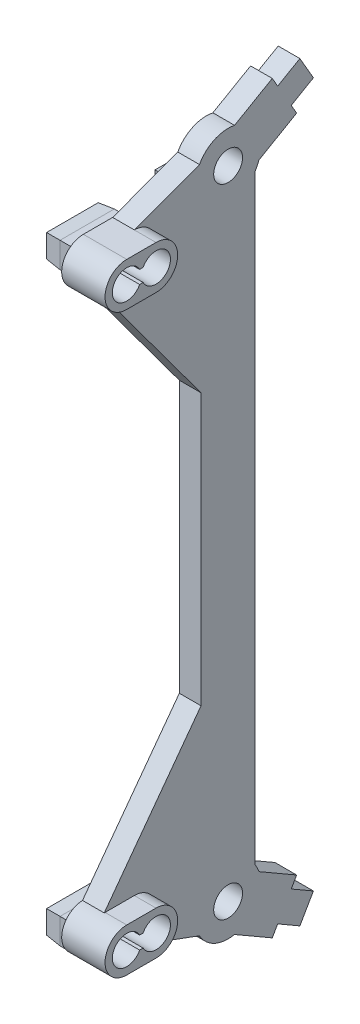
from build123d import *

# Parameters (mm, degrees)
SKETCH3_R                   = 3.81
DOWELSUPPORT_DEPTH          = 1.27
SKETCH5_W                   = 6.35
SKETCH5_H                   = 44.45
SLIDERDOWELSUPPORT_DEPTH    = 1.27
LATERALSUPPORT_DEPTH        = 1.27
SKETCH8_W                   = 6.35
SKETCH8_H                   = 3
TABSUPPORT_DEPTH            = 1.27
STRINGDOWELSUPPORT_START    = -1.27
STRINGDOWELSUPPORT_DEPTH    = 5.08
INTERSUPPORT_DEPTH          = 1.27
SKETCH10_W                  = 6.35
SKETCH10_H                  = 3
TABBASE_DEPTH               = 1.27
SKETCH12_W                  = 6.35
SKETCH12_H                  = 3
TABDRAFT_DEPTH              = 1.73
TABDRAFT_DRAFT              = 5
TABDRAFT_PROFILE_2_DEPTH    = 1.73
TABDRAFT_PROFILE_2_DRAFT    = 5
STRINGDOWELHOLES_DEPTH      = 48.469574456
STRINGDOWELHOLES_DEPTH_BACK = 1.524
SKETCH14_R                  = 1.690500048
PULLEYDOWELHOLE_DEPTH       = 2.54


with BuildPart() as part:
    # Sketch3 → DowelSupport (new, symmetric)
    with BuildSketch(Plane(origin=(0, 0, 0), x_dir=(0, 0, -1), z_dir=(1, 0, 0))):
        with Locations((0, 37.30625)):
            Circle(SKETCH3_R)
    extrude(amount=DOWELSUPPORT_DEPTH, both=True)

    # Sketch8 → TabSupport (add, symmetric)
    with BuildSketch(Plane(origin=(0, 0, 0), x_dir=(0, 0, -1), z_dir=(1, 0, 0))):
        with Locations((0, 34.29)):
            Rectangle(SKETCH8_W, SKETCH8_H)
        with Locations((-12.7, 34.29)):
            Rectangle(SKETCH8_W, SKETCH8_H)
    extrude(amount=TABSUPPORT_DEPTH, both=True)


with BuildPart() as body_2:
    # Sketch5 → SliderDowelSupport (new, symmetric)
    with BuildSketch(Plane(origin=(0, 0, 0), x_dir=(0, 0, -1), z_dir=(1, 0, 0))):
        Rectangle(SKETCH5_W, SKETCH5_H)
    extrude(amount=SLIDERDOWELSUPPORT_DEPTH, both=True)



with BuildPart() as body_3:
    # Sketch6 → LateralSupport (new, symmetric)
    with BuildSketch(Plane(origin=(0, 0, 0), x_dir=(0, 0, -1), z_dir=(1, 0, 0))):
        Polygon((7.392863577, 39.741434671), (5.805363577, 42.491065329), (8.403439788, 43.991065329), (9.990939788, 41.241434671), align=None)
    extrude(amount=LATERALSUPPORT_DEPTH, both=True)


with BuildPart() as tabsupport_piece_1:
    # of the separate pieces the step leaves, piece 1, a body of its own (tabsupport_pieces)
    add(part.part.solids().sort_by_distance((1.27, 35.200193258, 3.175))[0])


with BuildPart() as tabsupport_piece_2:
    # of the separate pieces the step leaves, piece 2, a body of its own (tabsupport_pieces)
    add(part.part.solids().sort_by_distance((-1.27, 32.79, 9.525))[0])

    # Sketch15 → StringDowelSupport (add)
    with BuildSketch(Plane(origin=(0, 0, 0), x_dir=(0, 0, -1), z_dir=(1, 0, 0)).offset(STRINGDOWELSUPPORT_START)):
        with BuildLine():
            Line((-14.4145, 36.298), (-10.9855, 36.298))
            ThreePointArc((-10.9855, 36.298), (-8.4455, 33.758), (-10.9855, 31.218))
            Line((-10.9855, 31.218), (-14.4145, 31.218))
            ThreePointArc((-14.4145, 31.218), (-16.9545, 33.758), (-14.4145, 36.298))
        make_face()
    extrude(amount=STRINGDOWELSUPPORT_DEPTH)


with BuildPart() as body_2_1:
    add(body_2.part)

    add(body_3.part)  # InterSupport merges body 3

    add(tabsupport_piece_1.part)  # InterSupport merges TabSupport piece 1

    add(tabsupport_piece_2.part)  # InterSupport merges TabSupport piece 2
    # Sketch7 → InterSupport (add, symmetric)
    with BuildSketch(Plane(origin=(0, 0, 0), x_dir=(0, 0, -1), z_dir=(1, 0, 0))):
        Polygon((-15.691284512, 32.81461378), (-3.175, 15.875), (-3.175, 22.225), (3.175, 22.225), (3.175, 32.79), (0.989321966, 34.625476176), (-0.989321966, 39.987023824), (-10.9855, 36.298), (-14.4145, 36.298), align=None)
        Polygon((5.170363577, 43.590917591), (8.027863577, 38.641582409), (1.42875, 34.831582409), (-1.42875, 39.780917591), align=None)
    extrude(amount=INTERSUPPORT_DEPTH, both=True)

    # Sketch10 → TabBase (add)
    with BuildSketch(Plane.ZY.offset(1.27)):
        with Locations((0, 34.29)):
            Rectangle(SKETCH10_W, SKETCH10_H)
        with Locations((12.7, 34.29)):
            Rectangle(SKETCH10_W, SKETCH10_H)
    extrude(amount=TABBASE_DEPTH)


with BuildPart() as tabdraft_tool:
    # Sketch12 → TabDraft (with draft: the straight prism first)
    with BuildSketch(Plane.ZY.offset(2.54)):
        with Locations((0, 34.29)):
            Rectangle(SKETCH12_W, SKETCH12_H)
    extrude(amount=TABDRAFT_DEPTH)
    # TabDraft: the draft: its side faces are tilted about the plane it starts from
    tabdraft_sides = [tabdraft_tool.faces().sort_by_distance(p)[0] for p in [
        (-3.405, 34.29, 3.175),
        (-3.405, 35.79, 0),
        (-3.405, 34.29, -3.175),
        (-3.405, 32.79, 0),
    ]]
    draft(tabdraft_sides, Plane.ZY.offset(2.54), TABDRAFT_DRAFT)


with BuildPart() as body_2_2:
    add(body_2_1.part)

    # TabDraft: add tabdraft_tool
    add(tabdraft_tool.part)


with BuildPart() as tabdraft_profile_2_tool:
    # Sketch12 → TabDraft profile 2 (with draft: the straight prism first)
    with BuildSketch(Plane.ZY.offset(2.54)):
        with Locations((12.7, 34.29)):
            Rectangle(SKETCH12_W, SKETCH12_H)
    extrude(amount=TABDRAFT_PROFILE_2_DEPTH)
    # TabDraft profile 2: the draft: its side faces are tilted about the plane it starts from
    tabdraft_profile_2_sides = [tabdraft_profile_2_tool.faces().sort_by_distance(p)[0] for p in [
        (-3.405, 34.29, 9.525),
        (-3.405, 32.79, 12.7),
        (-3.405, 34.29, 15.875),
        (-3.405, 35.79, 12.7),
    ]]
    draft(tabdraft_profile_2_sides, Plane.ZY.offset(2.54), TABDRAFT_PROFILE_2_DRAFT)


with BuildPart() as body_2_3:
    add(body_2_2.part)

    # TabDraft profile 2: add tabdraft_profile_2_tool
    add(tabdraft_profile_2_tool.part)

    # Sketch16 → StringDowelHoles (cut, two sides: drawn at the far end of the back side and taken through both)
    with BuildSketch(Plane(origin=(1.27, 0, 0), x_dir=(0, 0, -1), z_dir=(1, 0, 0)).offset(-STRINGDOWELHOLES_DEPTH_BACK)):
        with BuildLine():
            Line((-12.905478326, 32.996), (-12.494521674, 32.996))
            ThreePointArc((-12.494521674, 32.996), (-9.294999952, 33.758), (-12.494521674, 34.52))
            Line((-12.494521674, 34.52), (-12.905478326, 34.52))
            ThreePointArc((-12.905478326, 34.52), (-16.105000048, 33.758), (-12.905478326, 32.996))
        make_face()
    extrude(amount=STRINGDOWELHOLES_DEPTH + STRINGDOWELHOLES_DEPTH_BACK, mode=Mode.SUBTRACT)

    # Sketch14 → PulleyDowelHole (cut)
    with BuildSketch(Plane(origin=(1.27, 0, 0), x_dir=(0, 0, -1), z_dir=(1, 0, 0))):
        with Locations((0, 37.30625)):
            Circle(SKETCH14_R)
    extrude(amount=-PULLEYDOWELHOLE_DEPTH, mode=Mode.SUBTRACT)

    # Mirror1: body 2 across plane


with BuildPart() as body_2_4:
    add(body_2_3.part)
    add(body_2_3.part.mirror(Plane.ZX))


solid = body_2_4.part
